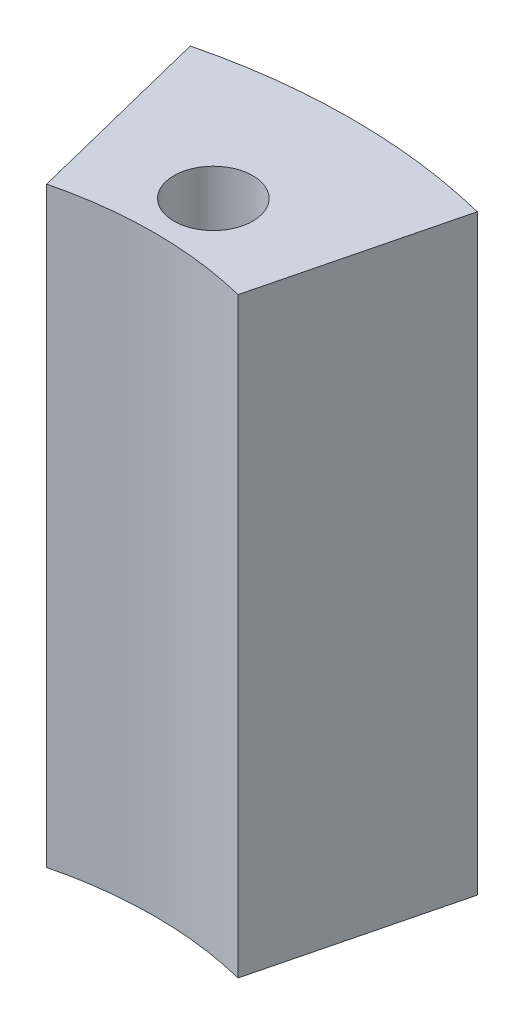
from build123d import *

# Parameters (mm, degrees)
BOSS_EXTRUDE2_DEPTH = 30
SKETCH3_R           = 1.5
CUT_EXTRUDE1_DEPTH  = 6
SKETCH4_R           = 2
CUT_EXTRUDE2_DEPTH  = 6


with BuildPart() as part:
    # Sketch1 → Boss-Extrude2 (new body)
    with BuildSketch(Plane(origin=(0, 0, 0), x_dir=(1, 0, 0), z_dir=(0, 1, 0))):
        with BuildLine():
            Line((-4.850712501, 19.402850003), (-7.276068751, 29.104275004))
            ThreePointArc((-7.276068751, 29.104275004), (0, 30), (7.276068751, 29.104275004))
            Line((7.276068751, 29.104275004), (4.850712501, 19.402850003))
            ThreePointArc((4.850712501, 19.402850003), (0, 20), (-4.850712501, 19.402850003))
        make_face()
    extrude(amount=BOSS_EXTRUDE2_DEPTH)

    # Sketch3 → Cut-Extrude1 (cut)
    with BuildSketch(Plane.XZ):
        with Locations(Location((0, -25.024693025, 0), (0, 0, 270))):
            Circle(SKETCH3_R)
    extrude(amount=-CUT_EXTRUDE1_DEPTH, mode=Mode.SUBTRACT)

    # Sketch4 → Cut-Extrude2 (cut)
    with BuildSketch(Plane(origin=(0, 30, 0), x_dir=(1, 0, 0), z_dir=(0, 1, 0))):
        with Locations(Location((0, 23, 0), (0, 0, 270))):
            Circle(SKETCH4_R)
    extrude(amount=-CUT_EXTRUDE2_DEPTH, mode=Mode.SUBTRACT)


solid = part.part
